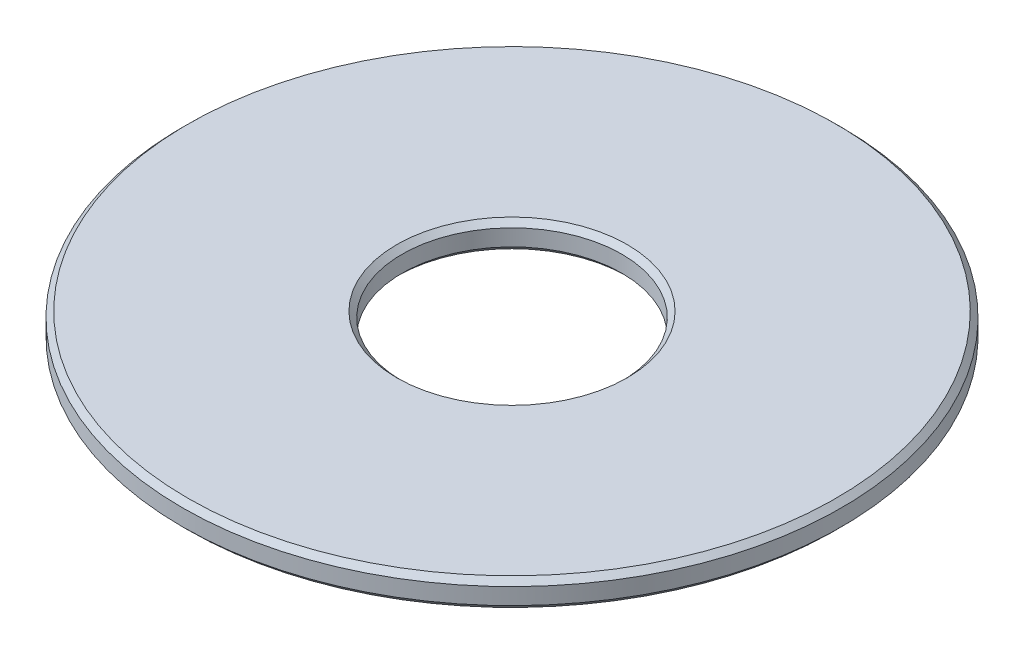
from build123d import *

# Parameters (mm, degrees)
SKETCH1_R           = 6
SKETCH1_R_2         = 2
BOSS_EXTRUDE1_DEPTH = 0.5
CHAMFER1_SIZE       = 0.1


with BuildPart() as part:
    # Sketch1 → Boss-Extrude1 (new body)
    with BuildSketch(Plane(origin=(0, 0, 0), x_dir=(1, 0, 0), z_dir=(0, 1, 0))):
        with Locations(Location((0, 0, 0), (0, 0, 270))):
            Circle(SKETCH1_R)
        with Locations(Location((0, 0, 0), (0, 0, 270))):
            Circle(SKETCH1_R_2, mode=Mode.SUBTRACT)
    extrude(amount=BOSS_EXTRUDE1_DEPTH)

    # Chamfer1
    chamfer1_edges = [part.edges().sort_by_distance(p)[0] for p in [
        (0, 0, -6),
        (0, 0.5, -6),
        (0, 0, -2),
        (0, 0.5, -2),
    ]]
    chamfer(chamfer1_edges, length=CHAMFER1_SIZE)


solid = part.part
